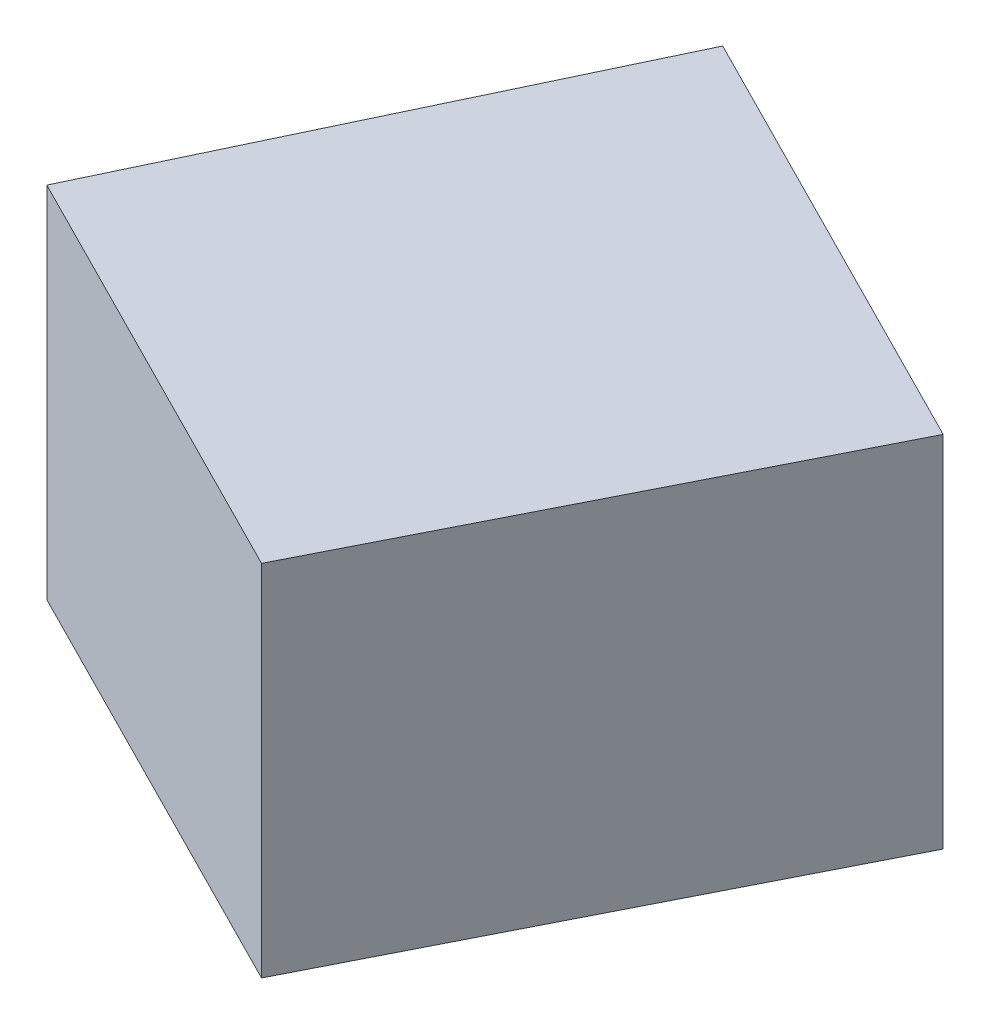
from build123d import *

# Parameters (mm, degrees)
BOSS_EXTRUDE1_DEPTH = 57


with BuildPart() as part:
    # Sketch1 → Boss-Extrude1 (new body)
    with BuildSketch(Plane(origin=(0, 0, 0), x_dir=(1, 0, 0), z_dir=(0, 1, 0))):
        Polygon((-61.056591485, -7.280446556), (7.987085874, -42.239270535), (44.357014022, 29.591337558), (-26.534752805, 65.48590304), align=None)
    extrude(amount=BOSS_EXTRUDE1_DEPTH)


solid = part.part
